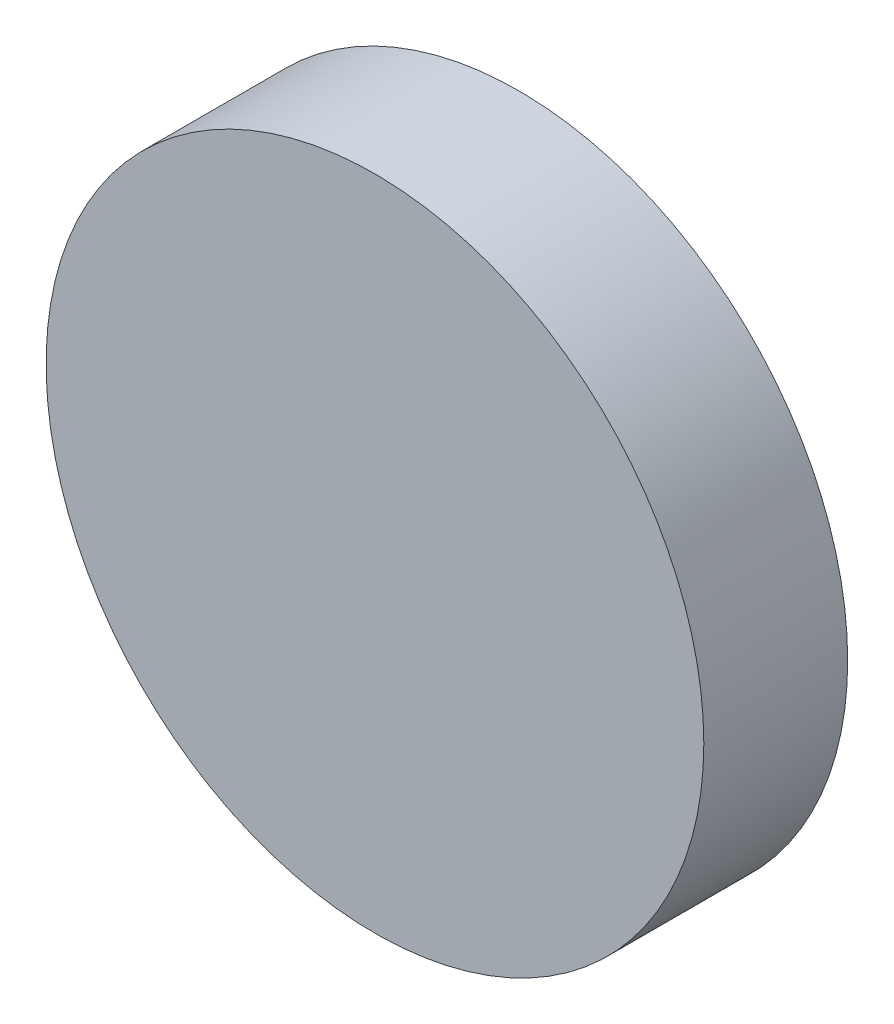
from build123d import *

# Parameters (mm, degrees)
SKETCH1_R     = 16
PROFILE_DEPTH = 7


with BuildPart() as part:
    # Sketch1 → Profile (new body)
    with BuildSketch(Plane.XY):
        with Locations((16, 16)):
            Circle(SKETCH1_R)
    extrude(amount=PROFILE_DEPTH)


solid = part.part
